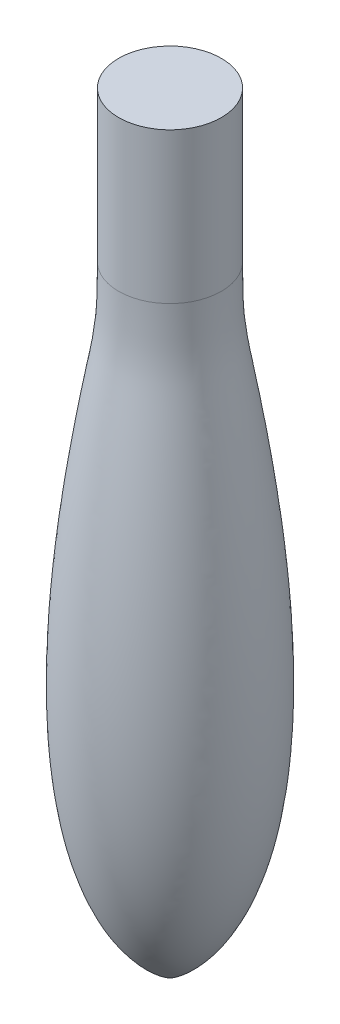
from build123d import *


with BuildPart() as part:
    # Sketch1 → Revolve1 (revolve)
    with BuildSketch(Plane(origin=(0, 0, 0), x_dir=(0, 0, -1), z_dir=(1, 0, 0)), mode=Mode.PRIVATE) as revolve1_sk:
        with BuildLine():
            Line((0, 29.3), (0, -120.7))
            add(Edge.make_bspline(
                [(10, 0), (10, -9.375039481), (11.165365254, -16.099609477), (26.638797439, -104.841417598), (0, -120.7)],
                knots=[0, 0, 0, 0, 0.245942112, 1, 1, 1, 1], degree=3))
            Line((10, 0), (10, 29.3))
            Line((10, 29.3), (0, 29.3))
        make_face()
    revolve(revolve1_sk.sketch.rotate(Axis((0, 29.3, 0), (0, -1, 0)), 180), axis=Axis((0, 29.3, 0), (0, -1, 0)))


solid = part.part
